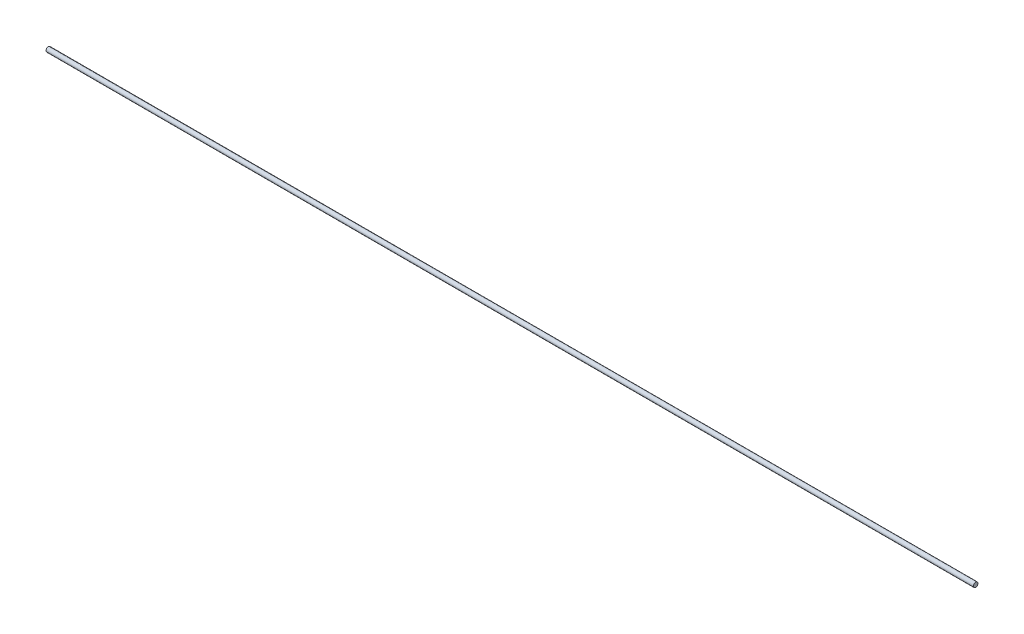
from build123d import *

# Parameters (mm, degrees)
SKETCH_1_R      = 0.5
EXTRUDE_1_DEPTH = 200


with BuildPart() as part:
    # 草图1 → 凸台-拉伸1 (new body)
    with BuildSketch(Plane(origin=(0, 0, 0), x_dir=(0, 0, -1), z_dir=(1, 0, 0))):
        Circle(SKETCH_1_R)
    extrude(amount=EXTRUDE_1_DEPTH)


solid = part.part
